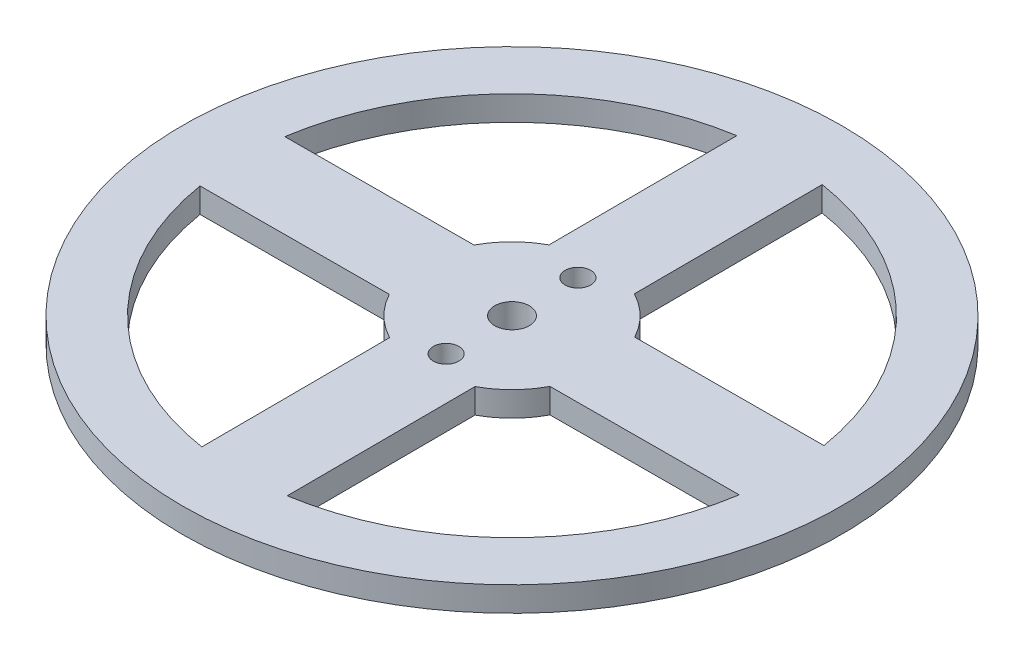
from build123d import *

# Parameters (mm, degrees)
SKETCH_1_R          = 40
SKETCH_1_R_2        = 1.55
EXTRUDE_1_DEPTH     = 3
SKETCH_5_R          = 2.1
CUT_EXTRUDE_4_DEPTH = 10
CUT_EXTRUDE_5_DEPTH = 10


with BuildPart() as part:
    # 草图1 → 凸台-拉伸1 (new body)
    with BuildSketch(Plane(origin=(0, 0, 0), x_dir=(1, 0, 0), z_dir=(0, 1, 0))):
        with Locations(Location((0, 0, 0), (0, 0, 270))):
            Circle(SKETCH_1_R)
        with Locations(Location((0, 8, 0), (0, 0, 270))):
            Circle(SKETCH_1_R_2, mode=Mode.SUBTRACT)
        with Locations(Location((0, -8, 0), (0, 0, 270))):
            Circle(SKETCH_1_R_2, mode=Mode.SUBTRACT)
    extrude(amount=EXTRUDE_1_DEPTH)

    # 草图5 → 切除-拉伸4 (cut)
    with BuildSketch(Plane(origin=(0, 3, 0), x_dir=(1, 0, 0), z_dir=(0, 1, 0))):
        with Locations(Location((0, 0, 0), (0, 0, 270))):
            Circle(SKETCH_5_R)
    extrude(amount=-CUT_EXTRUDE_4_DEPTH, mode=Mode.SUBTRACT)

    # 草图4 → 切除-拉伸5 (cut)
    with BuildSketch(Plane(origin=(0, 3, 0), x_dir=(1, 0, 0), z_dir=(0, 1, 0))):
        with BuildLine():
            Line((-5.199210429, 9.693720179), (-5.286154205, 32.573863353))
            ThreePointArc((-5.286154205, 32.573863353), (-23.423025076, 23.245685542), (-32.613096487, 5.038445946))
            Line((-32.613096487, 5.038445946), (-9.732953313, 5.125389722))
            ThreePointArc((-9.732953313, 5.125389722), (-7.807675025, 7.748561847), (-5.199210429, 9.693720179))
        make_face()
        with BuildLine():
            ThreePointArc((32.573863353, 5.286154205), (23.245685542, 23.423025076), (5.038445946, 32.613096487))
            Line((5.038445946, 32.613096487), (5.125389722, 9.732953313))
            ThreePointArc((5.125389722, 9.732953313), (7.748561847, 7.807675025), (9.693720179, 5.199210429))
            Line((9.693720179, 5.199210429), (32.573863353, 5.286154205))
        make_face()
        with BuildLine():
            ThreePointArc((5.286154205, -32.573863353), (23.423025076, -23.245685542), (32.613096487, -5.038445946))
            Line((32.613096487, -5.038445946), (9.732953313, -5.125389722))
            ThreePointArc((9.732953313, -5.125389722), (7.807675025, -7.748561847), (5.199210429, -9.693720179))
            Line((5.199210429, -9.693720179), (5.286154205, -32.573863353))
        make_face()
        with BuildLine():
            Line((-9.693720179, -5.199210429), (-32.573863353, -5.286154205))
            ThreePointArc((-32.573863353, -5.286154205), (-23.245685542, -23.423025076), (-5.038445946, -32.613096487))
            Line((-5.038445946, -32.613096487), (-5.125389722, -9.732953313))
            ThreePointArc((-5.125389722, -9.732953313), (-7.748561847, -7.807675025), (-9.693720179, -5.199210429))
        make_face()
    extrude(amount=-CUT_EXTRUDE_5_DEPTH, mode=Mode.SUBTRACT)


solid = part.part
